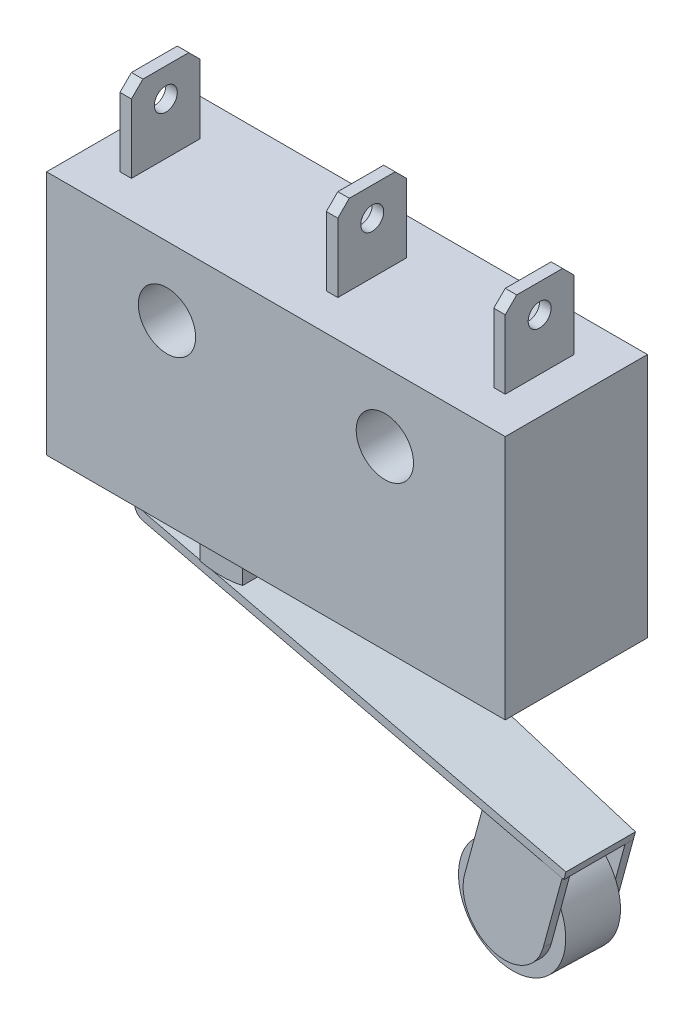
from build123d import *

# Parameters (mm, degrees)
SKETCH1_W           = 20
SKETCH1_H           = 10.7
BOSS_EXTRUDE1_DEPTH = 3.1
SKETCH2_W           = 0.5
SKETCH2_H           = 3.5
BOSS_EXTRUDE2_DEPTH = 1.5
CHAMFER1_SIZE       = 0.5
CUT_EXTRUDE1_REACH  = 25.448
SKETCH3_R           = 0.5
SKETCH4_R           = 1.25
CUT_EXTRUDE2_DEPTH  = 26.299802371
BOSS_EXTRUDE3_DEPTH = 2
DRAFT10_ANGLE       = 1.5
BOSS_EXTRUDE4_DEPTH = 0.35
SKETCH8_R           = 2.4
BOSS_EXTRUDE5_DEPTH = 2.330082213


with BuildPart() as part:
    # Sketch1 → Boss-Extrude1 (new, symmetric)
    with BuildSketch(Plane.XY):
        with Locations((10, 5.35)):
            Rectangle(SKETCH1_W, SKETCH1_H)
    extrude(amount=BOSS_EXTRUDE1_DEPTH, both=True)

    # Sketch2 → Boss-Extrude2 (add, symmetric)
    with BuildSketch(Plane.XY):
        with Locations((1.85, 12.45)):
            Rectangle(SKETCH2_W, SKETCH2_H)
        with Locations((18.15, 12.45)):
            Rectangle(SKETCH2_W, SKETCH2_H)
        with Locations((10.85, 12.45)):
            Rectangle(SKETCH2_W, SKETCH2_H)
    extrude(amount=BOSS_EXTRUDE2_DEPTH, both=True)

    # Chamfer1
    chamfer1_edges = [part.edges().sort_by_distance(p)[0] for p in [
        (1.85, 14.2, -1.5),
        (1.85, 14.2, 1.5),
        (18.15, 14.2, -1.5),
        (18.15, 14.2, 1.5),
        (10.85, 14.2, -1.5),
        (10.85, 14.2, 1.5),
    ]]
    chamfer(chamfer1_edges, length=CHAMFER1_SIZE)

    # Cut-Extrude1: up to this face of the body (flat: up to its plane)
    cut_extrude1_end = Plane(part.part.faces().sort_by_distance((1.6, 12.411382114, 0))[0])
    # Sketch3 → Cut-Extrude1 (cut, up to the picked face)
    with BuildSketch(Plane(origin=(18.4, 0, 0), x_dir=(0, 0, -1), z_dir=(1, 0, 0)), mode=Mode.PRIVATE) as cut_extrude1_sk1:
        with Locations(Location((0, 12.95, 0), (0, 0, 90))):
            Circle(SKETCH3_R)
    cut_extrude1_tool1 = split(extrude(cut_extrude1_sk1.sketch, amount=-CUT_EXTRUDE1_REACH, mode=Mode.PRIVATE), bisect_by=cut_extrude1_end, keep=Keep.BOTH, mode=Mode.PRIVATE)
    add(cut_extrude1_tool1.solids().sort_by(Axis((18.4, 12.95, 0), (-1, 0, 0)))[0], mode=Mode.SUBTRACT)

    # Sketch4 → Cut-Extrude2 (cut, through all)
    with BuildSketch(Plane(origin=(0, 0, -3.1), x_dir=(-1, 0, 0), z_dir=(0, 0, -1))):
        with Locations((-5.25, 7.7)):
            Circle(SKETCH4_R)
        with Locations((-14.75, 7.7)):
            Circle(SKETCH4_R)
    extrude(amount=-CUT_EXTRUDE2_DEPTH, mode=Mode.SUBTRACT)

    # Sketch5 → Boss-Extrude3 (add, symmetric)
    with BuildSketch(Plane.XY):
        with BuildLine():
            Line((2.75, 0), (2.75, -1))
            ThreePointArc((2.75, -1), (2.852752222, -1.303634983), (3.11877681, -1.482473289))
            Line((3.11877681, -1.482473289), (20.970288501, -6.337731302))
            Line((20.970288501, -6.337731302), (21.062144733, -6))
            Line((21.062144733, -6), (3.210633043, -1.144741987))
            ThreePointArc((3.210633043, -1.144741987), (3.130825667, -1.091090495), (3.1, -1))
            Line((3.1, -1), (3.1, 0))
            Line((3.1, 0), (2.75, 0))
        make_face()
        with BuildLine():
            Line((5.6, 0), (7.45, 0))
            Line((7.45, 0), (7.45, -1.75))
            ThreePointArc((7.45, -1.75), (6.525, -1.858422556), (5.6, -1.75))
            Line((5.6, -1.75), (5.6, 0))
        make_face()
    extrude(amount=BOSS_EXTRUDE3_DEPTH, both=True)

    # Draft10
    draft10_faces = [part.faces().sort_by_distance(p)[0] for p in [
        (11.436613636, -3.524482983, -2),
        (11.436613636, -3.524482983, 2),
    ]]
    draft(draft10_faces, Plane(origin=(3.279392904, -0.891929992, 0), x_dir=(0.26244637909853513, 0.9649465778467056, 0), z_dir=(0.9649465778467056, -0.26244637909853513, 0)), DRAFT10_ANGLE)

    # Sketch7 → Boss-Extrude4 (add)
    with BuildSketch(Plane(origin=(0.052748549, -0.014346562, -2.087562004), x_dir=(-0.9996809315410219, -0.0001699850736862716, -0.02525878497374093), z_dir=(0.02525935668815235, -0.006870045299250848, -0.9996573249755574))):
        with BuildLine():
            Line((-17.494148049, -5.03114496), (-21.016123341, -5.989367295))
            Line((-21.016123341, -5.989367295), (-20.097280006, -9.366603877))
            ThreePointArc((-20.097280006, -9.366603877), (-17.857181192, -10.648480355), (-16.575304714, -8.408381541))
            Line((-16.575304714, -8.408381541), (-17.494148049, -5.03114496))
        make_face()
    boss_extrude4 = extrude(amount=-BOSS_EXTRUDE4_DEPTH)

    # Mirror1: Boss-Extrude4 across plane
    add(boss_extrude4.mirror(Plane(origin=(0.014479585, -0.003938161, -0.573040064), x_dir=(0.9996809315475117, 0.00017358831123137617, 0.02525876021101414), z_dir=(0.02525935668815235, -0.006870045299250846, -0.9996573249755574))))

    # Sketch8 → Boss-Extrude5 (add)
    with BuildSketch(Plane(origin=(-0.014948604, 0.004065724, 0.591601811), x_dir=(-0.9996809315475117, -0.00017358831123137592, -0.025258760211014114), z_dir=(0.02525935668815233, -0.00687004529925084, -0.9996573249755573))):
        with Locations(Location((-18.336260335, -8.88755878, 0), (0, 0, 154.72118915))):
            Circle(SKETCH8_R)
    extrude(amount=BOSS_EXTRUDE5_DEPTH)


solid = part.part
